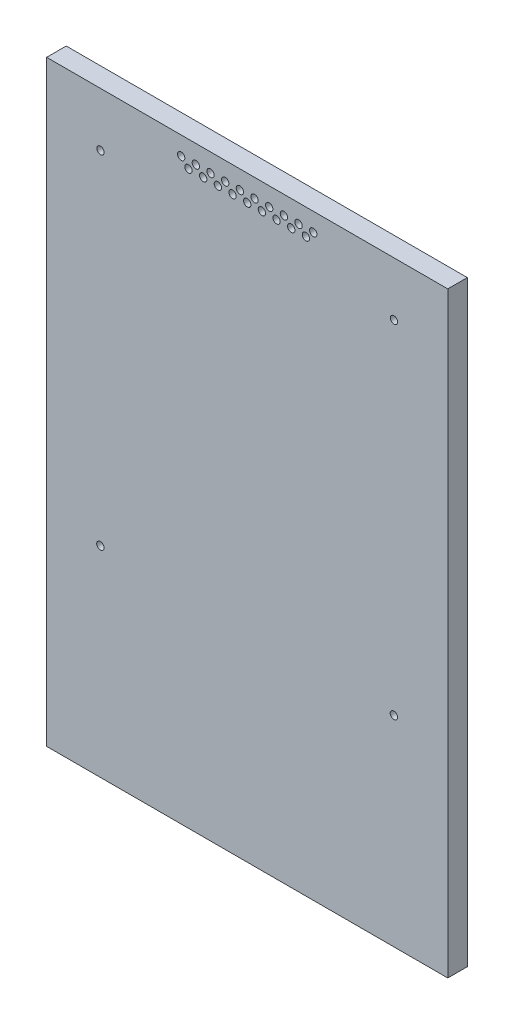
from build123d import *

# Parameters (mm, degrees)
SKETCH1_W           = 82
SKETCH1_H           = 122
BOSS_EXTRUDE1_DEPTH = 4
SKETCH2_W           = 76
SKETCH2_H           = 116
CUT_EXTRUDE1_DEPTH  = 0.0001
SKETCH6_W           = 78
SKETCH6_H           = 118
SKETCH6_W_2         = 76
SKETCH6_H_2         = 116
BOSS_EXTRUDE4_DEPTH = 1
SKETCH3_R           = 2
BOSS_EXTRUDE2_DEPTH = 1
SKETCH5_R           = 0.75
CUT_EXTRUDE2_DEPTH  = 74.66816816
SKETCH7_R           = 0.75
CUT_EXTRUDE3_DEPTH  = 74.607059444


with BuildPart() as part:
    # Sketch1 → Boss-Extrude1 (new body)
    with BuildSketch(Plane.XY):
        Rectangle(SKETCH1_W, SKETCH1_H)
    extrude(amount=-BOSS_EXTRUDE1_DEPTH)

    # Sketch2 → Cut-Extrude1 (cut)
    with BuildSketch(Plane(origin=(0, 0, -4), x_dir=(-1, 0, 0), z_dir=(0, 0, -1))):
        Rectangle(SKETCH2_W, SKETCH2_H)
    extrude(amount=-CUT_EXTRUDE1_DEPTH, mode=Mode.SUBTRACT)

    # Sketch6 → Boss-Extrude4 (add)
    with BuildSketch(Plane(origin=(0, 0, -4), x_dir=(-1, 0, 0), z_dir=(0, 0, -1))):
        Rectangle(SKETCH6_W, SKETCH6_H)
        Rectangle(SKETCH6_W_2, SKETCH6_H_2, mode=Mode.SUBTRACT)
    extrude(amount=BOSS_EXTRUDE4_DEPTH)

    # Sketch3 → Boss-Extrude2 (add)
    with BuildSketch(Plane(origin=(0, 0, -3.9999), x_dir=(-1, 0, 0), z_dir=(0, 0, -1))):
        with Locations(Location((30, 50, 0), (0, 0, 180))):
            Circle(SKETCH3_R)
        with Locations(Location((-30, 50, 0), (0, 0, 180))):
            Circle(SKETCH3_R)
        with Locations(Location((30, -20, 0), (0, 0, 180))):
            Circle(SKETCH3_R)
        with Locations(Location((-30, -20, 0), (0, 0, 180))):
            Circle(SKETCH3_R)
    extrude(amount=BOSS_EXTRUDE2_DEPTH)

    # Sketch5 → Cut-Extrude2 (cut, through all)
    with BuildSketch(Plane(origin=(0, 0, -4.9999), x_dir=(-1, 0, 0), z_dir=(0, 0, -1))):
        with Locations((-30, 50)):
            Circle(SKETCH5_R)
        with Locations((29.999997646, 50.016807976)):
            Circle(SKETCH5_R)
        with Locations((30.019606951, -19.983189277)):
            Circle(SKETCH5_R)
        with Locations((-29.980390695, -19.999997253)):
            Circle(SKETCH5_R)
    extrude(amount=-CUT_EXTRUDE2_DEPTH, mode=Mode.SUBTRACT)

    # Sketch7 → Cut-Extrude3 (cut, through all)
    with BuildSketch(Plane(origin=(0, 0, -3.9999), x_dir=(-1, 0, 0), z_dir=(0, 0, -1))):
        with Locations((13.5, 57.25)):
            Circle(SKETCH7_R)
        with Locations((10.5, 57.25)):
            Circle(SKETCH7_R)
        with Locations((7.5, 57.25)):
            Circle(SKETCH7_R)
        with Locations((4.5, 57.25)):
            Circle(SKETCH7_R)
        with Locations((1.5, 57.25)):
            Circle(SKETCH7_R)
        with Locations((-1.5, 57.25)):
            Circle(SKETCH7_R)
        with Locations((-4.5, 57.25)):
            Circle(SKETCH7_R)
        with Locations((-7.5, 57.25)):
            Circle(SKETCH7_R)
        with Locations((-10.5, 57.25)):
            Circle(SKETCH7_R)
        with Locations((-13.5, 57.25)):
            Circle(SKETCH7_R)
        with Locations((12, 55.75)):
            Circle(SKETCH7_R)
        with Locations((9, 55.75)):
            Circle(SKETCH7_R)
        with Locations((6, 55.75)):
            Circle(SKETCH7_R)
        with Locations((3, 55.75)):
            Circle(SKETCH7_R)
        with Locations((0, 55.75)):
            Circle(SKETCH7_R)
        with Locations((-3, 55.75)):
            Circle(SKETCH7_R)
        with Locations((-6, 55.75)):
            Circle(SKETCH7_R)
        with Locations((-9, 55.75)):
            Circle(SKETCH7_R)
        with Locations((-12, 55.75)):
            Circle(SKETCH7_R)
    extrude(amount=-CUT_EXTRUDE3_DEPTH, mode=Mode.SUBTRACT)


solid = part.part
